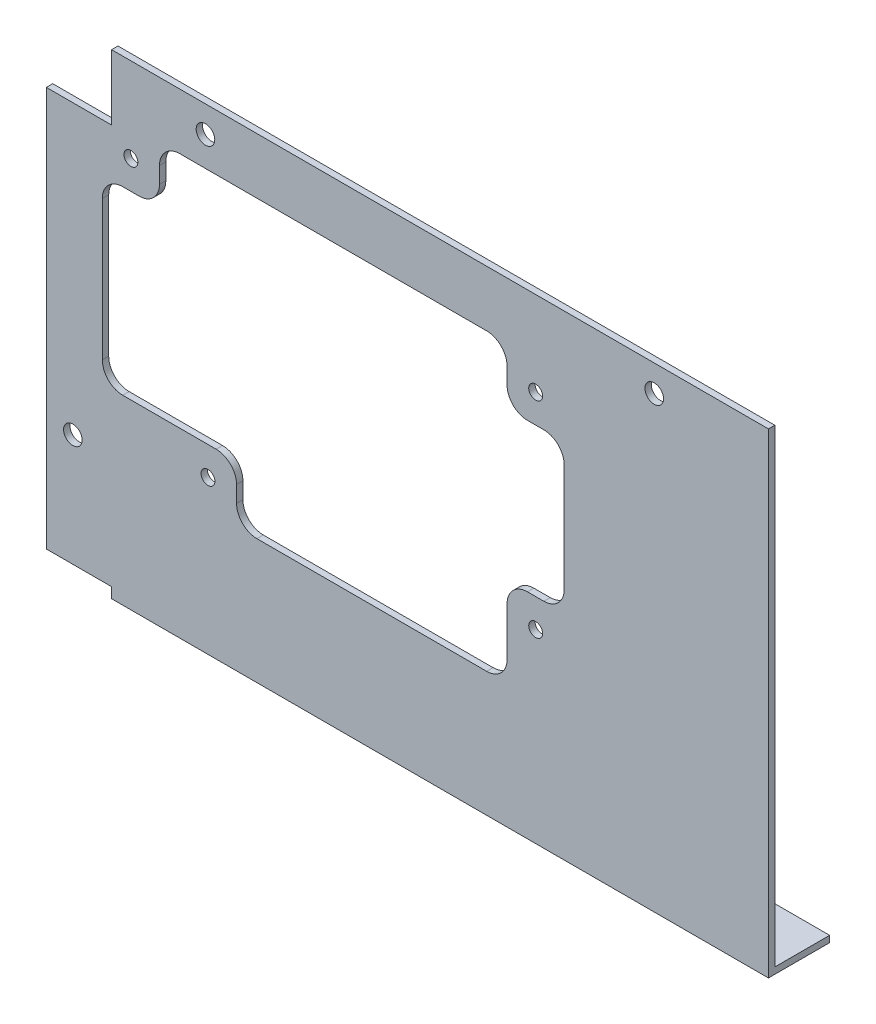
from build123d import *

# Parameters (mm, degrees)
SKETCH1_W            = 224.79
SKETCH1_H            = 146.05
BOSS_EXTRUDE1_DEPTH  = 1.98374
SKETCH2_W            = 20.32
SKETCH2_H            = 20.32
SKETCH2_H_2          = 1.27
CORNER_CUT_DEPTH     = 135.049326274
SKETCH3_R            = 2.159
PS_MOUNT_HOLES_DEPTH = 135.049326274
PS_CUTOUT_DEPTH      = 135.049326274
FILLET11_R           = 6.35
SKETCH5_R            = 2.8956
FRAME_MOUNTS_DEPTH   = 135.049326274
SKETCH8_W            = 204.47
SKETCH8_H            = 19.05
BOSS_EXTRUDE2_DEPTH  = 1.98374


with BuildPart() as part:
    # Sketch1 → Boss-Extrude1 (new body)
    with BuildSketch(Plane.XY):
        Rectangle(SKETCH1_W, SKETCH1_H)
    extrude(amount=BOSS_EXTRUDE1_DEPTH)

    # Sketch2 → Corner Cut (cut, through all)
    with BuildSketch(Plane.XY.offset(1.98374)):
        with Locations((-102.235, 62.865)):
            Rectangle(SKETCH2_W, SKETCH2_H)
        with Locations((-102.235, -72.39)):
            Rectangle(SKETCH2_W, SKETCH2_H_2)
    extrude(amount=-CORNER_CUT_DEPTH, mode=Mode.SUBTRACT)

    # Sketch3 → PS Mount Holes (cut, through all)
    with BuildSketch(Plane.XY.offset(1.98374)):
        with Locations((-86.075, 46.705)):
            Circle(SKETCH3_R)
        with Locations((-62.0776, -27.295)):
            Circle(SKETCH3_R)
        with Locations((39.925000098, -17.295)):
            Circle(SKETCH3_R)
        with Locations((39.925000098, 46.705)):
            Circle(SKETCH3_R)
    extrude(amount=-PS_MOUNT_HOLES_DEPTH, mode=Mode.SUBTRACT)

    # Sketch4 → PS Cutout (cut, through all)
    with BuildSketch(Plane.XY.offset(1.98374)):
        Polygon((-77.185, 55.595), (31.035000098, 55.595), (31.035000098, 37.815), (48.815000098, 37.815), (48.815000098, -8.405), (31.035000098, -8.405), (31.035000098, -36.185), (-53.1876, -36.185), (-53.1876, -18.405), (-94.965, -18.405), (-94.965, 37.815), (-77.185, 37.815), align=None)
    extrude(amount=-PS_CUTOUT_DEPTH, mode=Mode.SUBTRACT)

    # Fillet11
    fillet11_edges = [part.edges().sort_by_distance(p)[0] for p in [
        (-77.185, 37.815, 0.99187),
        (-77.185, 55.595, 0.99187),
        (31.035000098, 55.595, 0.99187),
        (31.035000098, 37.815, 0.99187),
        (48.815000098, 37.815, 0.99187),
        (48.815000098, -8.405, 0.99187),
        (31.035000098, -8.405, 0.99187),
        (31.035000098, -36.185, 0.99187),
        (-53.1876, -36.185, 0.99187),
        (-53.1876, -18.405, 0.99187),
        (-94.965, -18.405, 0.99187),
        (-94.965, 37.815, 0.99187),
    ]]
    fillet(fillet11_edges, radius=FILLET11_R)

    # Sketch5 → Frame-Mounts (cut, through all)
    with BuildSketch(Plane.XY.offset(1.98374)):
        with Locations((-62.865, 64.77)):
            Circle(SKETCH5_R)
        with Locations((76.835, 64.77)):
            Circle(SKETCH5_R)
        with Locations((-104.14, -36.83)):
            Circle(SKETCH5_R)
    extrude(amount=-FRAME_MOUNTS_DEPTH, mode=Mode.SUBTRACT)

    # Sketch8 → Boss-Extrude2 (add)
    with BuildSketch(Plane.XZ.offset(73.025)):
        with Locations((10.16, -7.54126)):
            Rectangle(SKETCH8_W, SKETCH8_H)
    extrude(amount=BOSS_EXTRUDE2_DEPTH)


solid = part.part
